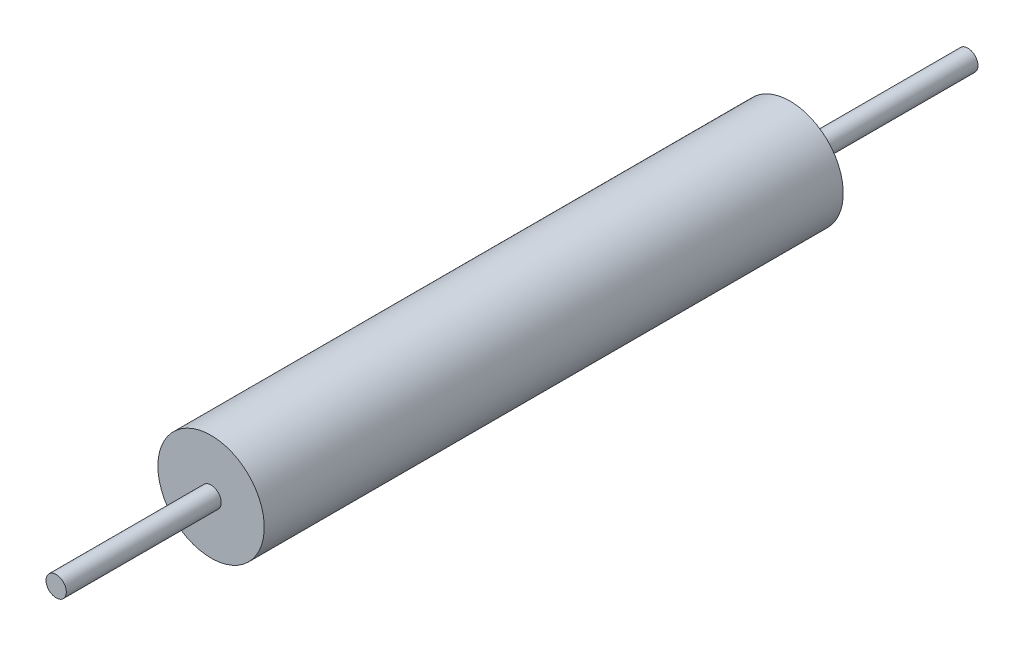
from build123d import *

# Parameters (mm, degrees)
SKETCH1_R           = 20.94
SKETCH1_R_2         = 4
SKETCH1_R_3         = 3.95
BOSS_EXTRUDE1_DEPTH = 228
SKETCH1_3_R         = 4
BOSS_EXTRUDE2_DEPTH = 70
BOSS_EXTRUDE4_START = 289
SKETCH1_5_R         = 4
SKETCH1_5_R_2       = 3.95
BOSS_EXTRUDE4_DEPTH = 61


with BuildPart() as part:
    # Sketch1 → Boss-Extrude1 (new body)
    # profile 1 of 3: a face of its own
    with BuildSketch(Plane.XY):
        with Locations(Location((0, 0, 0), (0, 0, 180))):
            Circle(SKETCH1_R)
        Circle(SKETCH1_R_2, mode=Mode.SUBTRACT)
    # profile 2 of 3: a face of its own
    with BuildSketch(Plane.XY):
        Circle(SKETCH1_R_2)
        Circle(SKETCH1_R_3, mode=Mode.SUBTRACT)
    # profile 3 of 3: a face of its own
    with BuildSketch(Plane.XY):
        Circle(SKETCH1_R_3)
    extrude(amount=BOSS_EXTRUDE1_DEPTH)

    # Sketch1<3> → Boss-Extrude2 (add)
    with BuildSketch(Plane.XY):
        Circle(SKETCH1_3_R)
    extrude(amount=-BOSS_EXTRUDE2_DEPTH)

    # Sketch1<5> → Boss-Extrude4 (add)
    # profile 1 of 2: a face of its own
    with BuildSketch(Plane.XY.offset(BOSS_EXTRUDE4_START)):
        Circle(SKETCH1_5_R)
        Circle(SKETCH1_5_R_2, mode=Mode.SUBTRACT)
    # profile 2 of 2: a face of its own
    with BuildSketch(Plane.XY.offset(BOSS_EXTRUDE4_START)):
        Circle(SKETCH1_5_R_2)
    extrude(amount=-BOSS_EXTRUDE4_DEPTH)


solid = part.part
